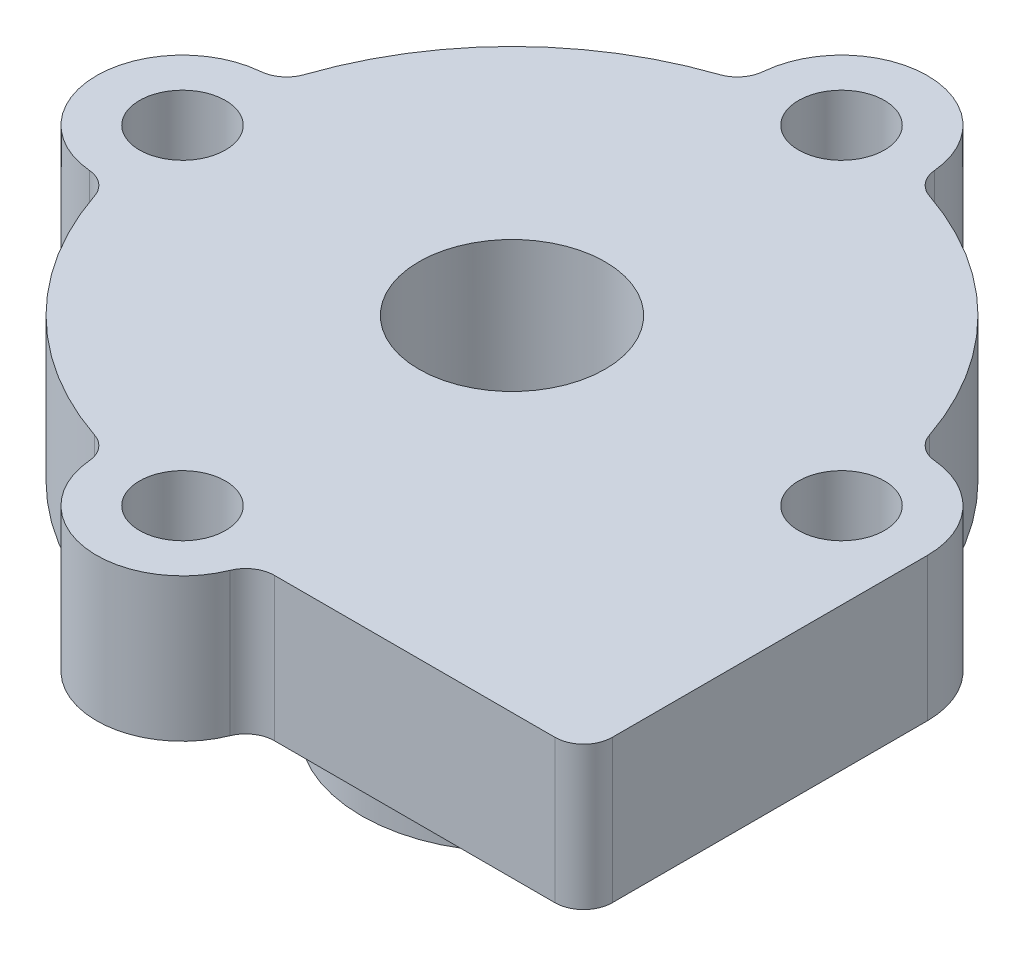
from build123d import *
from build123d.topology import SkipClean

# Parameters (mm, degrees)
SKETCH1_R           = 11.5
SKETCH1_R_2         = 3.25
BOSS_EXTRUDE1_DEPTH = 5
SKETCH3_R           = 3
BOSS_EXTRUDE2_DEPTH = 5
SKETCH4_R           = 1.5
CUT_EXTRUDE1_DEPTH  = 5
CIRPATTERN1_COUNT   = 4
BOSS_EXTRUDE3_DEPTH = 5
CIRPATTERN2_COUNT   = 4
BOSS_EXTRUDE4_START = 7.5
SKETCH6_R           = 5.25
SKETCH6_R_2         = 3.25
BOSS_EXTRUDE4_DEPTH = 7.5
FILLET2_R           = 1


with BuildPart() as part:
    # Sketch1 → Boss-Extrude1 (new body)
    with BuildSketch(Plane(origin=(0, 0, 0), x_dir=(1, 0, 0), z_dir=(0, 1, 0))):
        with Locations(Location((0, 0, 0), (0, 0, 270))):
            Circle(SKETCH1_R)
        with Locations(Location((0, 0, 0), (0, 0, 270))):
            Circle(SKETCH1_R_2, mode=Mode.SUBTRACT)
    extrude(amount=BOSS_EXTRUDE1_DEPTH)

    # Sketch3 → Boss-Extrude2 (add)
    with BuildSketch(Plane(origin=(0, 0, 0), x_dir=(1, 0, 0), z_dir=(0, 1, 0))):
        with Locations((0, 11.5)):
            Circle(SKETCH3_R)
    boss_extrude2 = extrude(amount=BOSS_EXTRUDE2_DEPTH)

    # Sketch4 → Cut-Extrude1 (cut)
    with BuildSketch(Plane(origin=(0, 5, 0), x_dir=(1, 0, 0), z_dir=(0, 1, 0))):
        with Locations(Location((0, 11.5, 0), (0, 0, 270))):
            Circle(SKETCH4_R)
    cut_extrude1 = extrude(amount=-CUT_EXTRUDE1_DEPTH, mode=Mode.SUBTRACT)

    # CirPattern1: Boss-Extrude2 ×4 about axis
    cirpattern1_axis = Axis((0, 0, 0), (0, 1, 0))
    for i in range(1, CIRPATTERN1_COUNT):
        add(boss_extrude2.rotate(cirpattern1_axis, i * 360 / CIRPATTERN1_COUNT))

    # Sketch5 → Boss-Extrude3 (add)
    with BuildSketch(Plane(origin=(0, 5, 0), x_dir=(1, 0, 0), z_dir=(0, 1, 0))):
        Polygon((0, -12), (14.5, -12), (14.5, 0), (10.271836612, 0), align=None)
    extrude(amount=-BOSS_EXTRUDE3_DEPTH)

    # CirPattern2: Cut-Extrude1 ×4 about axis
    cirpattern2_axis = Axis((0, 0, 0), (0, 1, 0))
    for i in range(1, CIRPATTERN2_COUNT):
        add(cut_extrude1.rotate(cirpattern2_axis, i * 360 / CIRPATTERN2_COUNT), mode=Mode.SUBTRACT)

    # Sketch6 → Boss-Extrude4 (add)
    with SkipClean():  # the faces are left unmerged after this step: merging them gives an invalid solid
        with BuildSketch(Plane.XZ.offset(BOSS_EXTRUDE4_START)):
            with Locations(Location((0, 0, 0), (0, 0, 90))):
                Circle(SKETCH6_R)
            with Locations(Location((0, 0, 0), (0, 0, 270))):
                Circle(SKETCH6_R_2, mode=Mode.SUBTRACT)
        extrude(amount=-BOSS_EXTRUDE4_DEPTH)

    # Fillet2
    fillet2_edges = [part.edges().sort_by_distance(p)[0] for p in [
        (-2.974370674, 2.5, -11.108695652),
        (2.974370674, 2.5, -11.108695652),
        (-11.108695652, 2.5, -2.974370674),
        (-11.108695652, 2.5, 2.974370674),
        (-2.974370674, 2.5, 11.108695652),
        (11.108695652, 2.5, -2.974370674),
        (2.958039892, 2.5, 12),
        (14.5, 2.5, 12),
        (0, 0, -5.25),
    ]]
    fillet(fillet2_edges, radius=FILLET2_R)


solid = part.part
